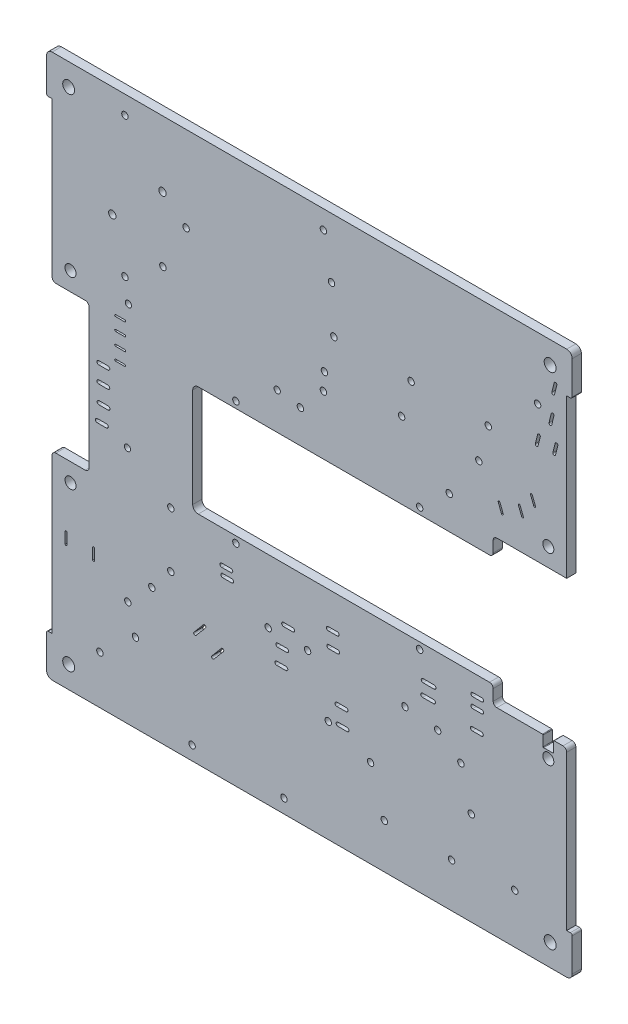
from build123d import *

# Parameters (mm, degrees)
SKETCH1_R           = 3
SKETCH1_R_2         = 3.25
SKETCH1_R_3         = 1.75
SKETCH1_R_4         = 2
SKETCH1_R_5         = 1.7
BOSS_EXTRUDE1_DEPTH = 5


with BuildPart() as part:
    # Sketch1 → Boss-Extrude1 (new body)
    with BuildSketch(Plane.XY):
        with BuildLine():
            Line((-60.5, 29.989761252), (98, 29.989761252))
            ThreePointArc((98, 29.989761252), (99.414213563, 30.57554769), (100, 31.989761252))
            Line((100, 31.989761252), (100, 37.971848155))
            ThreePointArc((100, 37.971848155), (100.585786438, 39.386061717), (102, 39.971848155))
            Line((102, 39.971848155), (140, 39.971848155))
            Line((140, 39.971848155), (140, 126))
            Line((140, 126), (142, 126))
            ThreePointArc((142, 126), (142.707106781, 126.292893219), (143, 127))
            Line((143, 127), (143, 145))
            ThreePointArc((143, 145), (142.121320344, 147.121320344), (140, 148))
            Line((140, 148), (-140, 148))
            ThreePointArc((-140, 148), (-142.121320344, 147.121320344), (-143, 145))
            Line((-143, 145), (-143, 127))
            ThreePointArc((-143, 127), (-142.707106781, 126.292893219), (-142, 126))
            Line((-142, 126), (-140, 126))
            Line((-140, 126), (-140, 41.971848155))
            ThreePointArc((-140, 41.971848155), (-139.414213563, 40.557634592), (-138, 39.971848155))
            Line((-138, 39.971848155), (-121.940250615, 39.971848155))
            ThreePointArc((-121.940250615, 39.971848155), (-120.526037052, 39.386061717), (-119.940250615, 37.971848155))
            Line((-119.940250615, 37.971848155), (-119.940250615, -38))
            ThreePointArc((-119.940250615, -38), (-120.526037052, -39.414213562), (-121.940250615, -40))
            Line((-121.940250615, -40), (-138, -40))
            ThreePointArc((-138, -40), (-139.414213563, -40.585786438), (-140, -42))
            Line((-140, -42), (-140, -126))
            Line((-140, -126), (-142, -126))
            ThreePointArc((-142, -126), (-142.707106781, -126.292893219), (-143, -127))
            Line((-143, -127), (-143, -145))
            ThreePointArc((-143, -145), (-142.121320344, -147.121320344), (-140, -148))
            Line((-140, -148), (140, -148))
            ThreePointArc((140, -148), (142.121320344, -147.121320344), (143, -145))
            Line((143, -145), (143, -127))
            ThreePointArc((143, -127), (142.707106781, -126.292893219), (142, -126))
            Line((142, -126), (140, -126))
            Line((140, -126), (140, -41.971848155))
            ThreePointArc((140, -41.971848155), (139.414213563, -40.557634592), (138, -39.971848155))
            Line((138, -39.971848155), (133.139339828, -39.971848155))
            ThreePointArc((133.139339828, -39.971848155), (132.927207794, -40.05971612), (132.839339828, -40.271848155))
            Line((132.839339828, -40.271848155), (132.839339828, -45.8))
            ThreePointArc((132.839339828, -45.8), (132.751471863, -46.012132034), (132.539339828, -46.1))
            Line((132.539339828, -46.1), (127.460660172, -46.1))
            ThreePointArc((127.460660172, -46.1), (127.248528137, -46.012132034), (127.160660172, -45.8))
            Line((127.160660172, -45.8), (127.160660172, -40.271848155))
            ThreePointArc((127.160660172, -40.271848155), (127.072792206, -40.05971612), (126.860660172, -39.971848155))
            Line((126.860660172, -39.971848155), (102, -39.971848155))
            ThreePointArc((102, -39.971848155), (100.585786438, -39.386061717), (100, -37.971848155))
            Line((100, -37.971848155), (100, -31.969286705))
            ThreePointArc((100, -31.969286705), (99.414213563, -30.555073142), (98, -29.969286705))
            Line((98, -29.969286705), (-60.5, -29.969286705))
            ThreePointArc((-60.5, -29.969286705), (-62.621320344, -29.090607048), (-63.5, -26.969286705))
            Line((-63.5, -26.969286705), (-63.5, 26.989761252))
            ThreePointArc((-63.5, 26.989761252), (-62.621320344, 29.111081596), (-60.5, 29.989761252))
        make_face()
        with Locations((130, 50)):
            Circle(SKETCH1_R, mode=Mode.SUBTRACT)
        with Locations((130, -50)):
            Circle(SKETCH1_R, mode=Mode.SUBTRACT)
        with Locations((-130, -50)):
            Circle(SKETCH1_R, mode=Mode.SUBTRACT)
        with Locations((-130, 50)):
            Circle(SKETCH1_R, mode=Mode.SUBTRACT)
        with Locations((-131, -136)):
            Circle(SKETCH1_R_2, mode=Mode.SUBTRACT)
        with Locations((131, -136)):
            Circle(SKETCH1_R_2, mode=Mode.SUBTRACT)
        with Locations((131, 136)):
            Circle(SKETCH1_R_2, mode=Mode.SUBTRACT)
        with Locations((-131, 136)):
            Circle(SKETCH1_R_2, mode=Mode.SUBTRACT)
        with Locations((111.735167126, -121.118147392)):
            Circle(SKETCH1_R_3, mode=Mode.SUBTRACT)
        with Locations((88.089296428, -97)):
            Circle(SKETCH1_R_3, mode=Mode.SUBTRACT)
        with Locations((-107.274737279, 87.823618227)):
            Circle(SKETCH1_R_4, mode=Mode.SUBTRACT)
        with Locations((-79.949331604, 112.172790794)):
            Circle(SKETCH1_R_4, mode=Mode.SUBTRACT)
        with Locations((-40, -33.489762726)):
            Circle(SKETCH1_R_3, mode=Mode.SUBTRACT)
        with Locations((60, -33.489762726)):
            Circle(SKETCH1_R_3, mode=Mode.SUBTRACT)
        with Locations((-40, 33.510237274)):
            Circle(SKETCH1_R_3, mode=Mode.SUBTRACT)
        with Locations((60, 33.510237274)):
            Circle(SKETCH1_R_3, mode=Mode.SUBTRACT)
        with Locations((-100.379541887, 62)):
            Circle(SKETCH1_R_3, mode=Mode.SUBTRACT)
        with Locations((-100.379541887, 138)):
            Circle(SKETCH1_R_3, mode=Mode.SUBTRACT)
        with Locations((7.620458113, 138)):
            Circle(SKETCH1_R_3, mode=Mode.SUBTRACT)
        with Locations((7.620458113, 62)):
            Circle(SKETCH1_R_3, mode=Mode.SUBTRACT)
        with Locations((-1, -64.5)):
            Circle(SKETCH1_R_3, mode=Mode.SUBTRACT)
        with Locations((52, -64.5)):
            Circle(SKETCH1_R_3, mode=Mode.SUBTRACT)
        with Locations((-75.417782129, -34.5)):
            Circle(SKETCH1_R_3, mode=Mode.SUBTRACT)
        with Locations((-75.417782129, -64.5)):
            Circle(SKETCH1_R_3, mode=Mode.SUBTRACT)
        with Locations((-22.417782129, -64.5)):
            Circle(SKETCH1_R_3, mode=Mode.SUBTRACT)
        with Locations((10.261866554, -92.30359925)):
            Circle(SKETCH1_R_3, mode=Mode.SUBTRACT)
        with Locations((-98.8, -90.511117637)):
            Circle(SKETCH1_R_3, mode=Mode.SUBTRACT)
        with Locations((-94.63536083, -105.074561655)):
            Circle(SKETCH1_R_3, mode=Mode.SUBTRACT)
        with Locations((-79.738533068, 76.998744433)):
            Circle(SKETCH1_R_3, mode=Mode.SUBTRACT)
        with Locations((-67.091659808, 101.631939393)):
            Circle(SKETCH1_R_3, mode=Mode.SUBTRACT)
        with Locations((-99, -18)):
            Circle(SKETCH1_R_5, mode=Mode.SUBTRACT)
        with Locations((-17.5, 50)):
            Circle(SKETCH1_R_5, mode=Mode.SUBTRACT)
        with Locations((-4.910703572, 48)):
            Circle(SKETCH1_R_3, mode=Mode.SUBTRACT)
        with Locations((-98.5, 50)):
            Circle(SKETCH1_R_5, mode=Mode.SUBTRACT)
        with Locations((76.089296428, 48)):
            Circle(SKETCH1_R_3, mode=Mode.SUBTRACT)
        with Locations((-13.827640689, -140.5)):
            Circle(SKETCH1_R_3, mode=Mode.SUBTRACT)
        with Locations((-63.827640689, -140.5)):
            Circle(SKETCH1_R_3, mode=Mode.SUBTRACT)
        with Locations((-114.01147389, -121.789083357)):
            Circle(SKETCH1_R_3, mode=Mode.SUBTRACT)
        with Locations((-85.744280955, -77.155295559)):
            Circle(SKETCH1_R_3, mode=Mode.SUBTRACT)
        with Locations((33.270940688, -100.113595946)):
            Circle(SKETCH1_R_3, mode=Mode.SUBTRACT)
        with Locations((82.412864467, -75.853711215)):
            Circle(SKETCH1_R_3, mode=Mode.SUBTRACT)
        with Locations((69.769451027, -66.675797144)):
            Circle(SKETCH1_R_3, mode=Mode.SUBTRACT)
        with Locations((124.173192615, 114.215338079)):
            Circle(SKETCH1_R_3, mode=Mode.SUBTRACT)
        with Locations((92.174345185, 71.467739287)):
            Circle(SKETCH1_R_3, mode=Mode.SUBTRACT)
        with Locations((97.33008389, 90.5)):
            Circle(SKETCH1_R_3, mode=Mode.SUBTRACT)
        with Locations((50.174345185, 71.467739287)):
            Circle(SKETCH1_R_3, mode=Mode.SUBTRACT)
        with Locations((55.33008389, 90.5)):
            Circle(SKETCH1_R_3, mode=Mode.SUBTRACT)
        with Locations((8.174345185, 71.467739287)):
            Circle(SKETCH1_R_3, mode=Mode.SUBTRACT)
        with Locations((13.33008389, 90.5)):
            Circle(SKETCH1_R_3, mode=Mode.SUBTRACT)
        with Locations((12.02216922, 115.450723129)):
            Circle(SKETCH1_R_3, mode=Mode.SUBTRACT)
        with Locations((40.756287932, -123.730711261)):
            Circle(SKETCH1_R_3, mode=Mode.SUBTRACT)
        with Locations((77.354553715, -124.087000003)):
            Circle(SKETCH1_R_3, mode=Mode.SUBTRACT)
        with BuildLine():
            Line((-131.911272873, -74.315327201), (-131.911272873, -80.315327201))
            ThreePointArc((-131.911272873, -80.315327201), (-132.411272873, -80.815327201), (-132.911272873, -80.315327201))
            Line((-132.911272873, -80.315327201), (-132.911272873, -74.315327201))
            ThreePointArc((-132.911272873, -74.315327201), (-132.411272873, -73.815327201), (-131.911272873, -74.315327201))
        make_face(mode=Mode.SUBTRACT)
        with BuildLine():
            Line((-116.911272873, -74.315327201), (-116.911272873, -80.315327201))
            ThreePointArc((-116.911272873, -80.315327201), (-117.411272873, -80.815327201), (-117.911272873, -80.315327201))
            Line((-117.911272873, -80.315327201), (-117.911272873, -74.315327201))
            ThreePointArc((-117.911272873, -74.315327201), (-117.411272873, -73.815327201), (-116.911272873, -74.315327201))
        make_face(mode=Mode.SUBTRACT)
        with BuildLine():
            Line((-105.436623555, 41.587008984), (-100.436623555, 41.587008984))
            ThreePointArc((-100.436623555, 41.587008984), (-99.936623555, 41.087008984), (-100.436623555, 40.587008984))
            Line((-100.436623555, 40.587008984), (-105.436623555, 40.587008984))
            ThreePointArc((-105.436623555, 40.587008984), (-105.936623555, 41.087008984), (-105.436623555, 41.587008984))
        make_face(mode=Mode.SUBTRACT)
        with BuildLine():
            Line((-105.436623555, 34.587008984), (-100.436623555, 34.587008984))
            ThreePointArc((-100.436623555, 34.587008984), (-99.936623555, 34.087008984), (-100.436623555, 33.587008984))
            Line((-100.436623555, 33.587008984), (-105.436623555, 33.587008984))
            ThreePointArc((-105.436623555, 33.587008984), (-105.936623555, 34.087008984), (-105.436623555, 34.587008984))
        make_face(mode=Mode.SUBTRACT)
        with BuildLine():
            Line((-105.436623555, 27.587008984), (-100.436623555, 27.587008984))
            ThreePointArc((-100.436623555, 27.587008984), (-99.936623555, 27.087008984), (-100.436623555, 26.587008984))
            Line((-100.436623555, 26.587008984), (-105.436623555, 26.587008984))
            ThreePointArc((-105.436623555, 26.587008984), (-105.936623555, 27.087008984), (-105.436623555, 27.587008984))
        make_face(mode=Mode.SUBTRACT)
        with BuildLine():
            Line((-105.436623555, 20.587008984), (-100.436623555, 20.587008984))
            ThreePointArc((-100.436623555, 20.587008984), (-99.936623555, 20.087008984), (-100.436623555, 19.587008984))
            Line((-100.436623555, 19.587008984), (-105.436623555, 19.587008984))
            ThreePointArc((-105.436623555, 19.587008984), (-105.936623555, 20.087008984), (-105.436623555, 20.587008984))
        make_face(mode=Mode.SUBTRACT)
        with BuildLine():
            Line((-56.506516854, -81.628617091), (-61.660412293, -87.747224923))
            ThreePointArc((-61.660412293, -87.747224923), (-62.717209475, -87.83766671), (-62.807651262, -86.780869528))
            Line((-62.807651262, -86.780869528), (-57.653755822, -80.662261696))
            ThreePointArc((-57.653755822, -80.662261696), (-56.59695864, -80.57181991), (-56.506516854, -81.628617091))
        make_face(mode=Mode.SUBTRACT)
        with BuildLine():
            Line((-53.083608186, -93.087243855), (-47.929712747, -86.968636023))
            ThreePointArc((-47.929712747, -86.968636023), (-46.872915565, -86.878194237), (-46.782473778, -87.934991418))
            Line((-46.782473778, -87.934991418), (-51.936369218, -94.05359925))
            ThreePointArc((-51.936369218, -94.05359925), (-52.9931664, -94.144041037), (-53.083608186, -93.087243855))
        make_face(mode=Mode.SUBTRACT)
        with BuildLine():
            Line((-114.631081019, 15.300232941), (-109.631081019, 15.300232941))
            ThreePointArc((-109.631081019, 15.300232941), (-108.631081019, 14.300232941), (-109.631081019, 13.300232941))
            Line((-109.631081019, 13.300232941), (-114.631081019, 13.300232941))
            ThreePointArc((-114.631081019, 13.300232941), (-115.631081019, 14.300232941), (-114.631081019, 15.300232941))
        make_face(mode=Mode.SUBTRACT)
        with BuildLine():
            Line((-114.631081019, 6.249710876), (-109.631081019, 6.249710876))
            ThreePointArc((-109.631081019, 6.249710876), (-108.631081019, 5.249710876), (-109.631081019, 4.249710876))
            Line((-109.631081019, 4.249710876), (-114.631081019, 4.249710876))
            ThreePointArc((-114.631081019, 4.249710876), (-115.631081019, 5.249710876), (-114.631081019, 6.249710876))
        make_face(mode=Mode.SUBTRACT)
        with BuildLine():
            Line((-114.492886616, -3.487647924), (-109.492886616, -3.487647924))
            ThreePointArc((-109.492886616, -3.487647924), (-108.492886616, -4.487647924), (-109.492886616, -5.487647924))
            Line((-109.492886616, -5.487647924), (-114.492886616, -5.487647924))
            ThreePointArc((-114.492886616, -5.487647924), (-115.492886616, -4.487647924), (-114.492886616, -3.487647924))
        make_face(mode=Mode.SUBTRACT)
        with BuildLine():
            Line((-115.445462796, -12.404175498), (-110.445462796, -12.404175498))
            ThreePointArc((-110.445462796, -12.404175498), (-109.445462796, -13.404175498), (-110.445462796, -14.404175498))
            Line((-110.445462796, -14.404175498), (-115.445462796, -14.404175498))
            ThreePointArc((-115.445462796, -14.404175498), (-116.445462796, -13.404175498), (-115.445462796, -12.404175498))
        make_face(mode=Mode.SUBTRACT)
        with BuildLine():
            Line((-14.064477053, -57.77802484), (-9.064477053, -57.77802484))
            ThreePointArc((-9.064477053, -57.77802484), (-8.064477053, -58.77802484), (-9.064477053, -59.77802484))
            Line((-9.064477053, -59.77802484), (-14.064477053, -59.77802484))
            ThreePointArc((-14.064477053, -59.77802484), (-15.064477053, -58.77802484), (-14.064477053, -57.77802484))
        make_face(mode=Mode.SUBTRACT)
        with BuildLine():
            Line((10.450688105, -55.936359309), (15.450688105, -55.936359309))
            ThreePointArc((15.450688105, -55.936359309), (16.450688105, -56.936359309), (15.450688105, -57.936359309))
            Line((15.450688105, -57.936359309), (10.450688105, -57.936359309))
            ThreePointArc((10.450688105, -57.936359309), (9.450688105, -56.936359309), (10.450688105, -55.936359309))
        make_face(mode=Mode.SUBTRACT)
        with BuildLine():
            Line((-47.703927261, -46.668691522), (-42.703927261, -46.668691522))
            ThreePointArc((-42.703927261, -46.668691522), (-41.703927261, -47.668691522), (-42.703927261, -48.668691522))
            Line((-42.703927261, -48.668691522), (-47.703927261, -48.668691522))
            ThreePointArc((-47.703927261, -48.668691522), (-48.703927261, -47.668691522), (-47.703927261, -46.668691522))
        make_face(mode=Mode.SUBTRACT)
        with BuildLine():
            Line((-47.240543871, -51.302525415), (-42.240543871, -51.302525415))
            ThreePointArc((-42.240543871, -51.302525415), (-41.240543871, -52.302525415), (-42.240543871, -53.302525415))
            Line((-42.240543871, -53.302525415), (-47.240543871, -53.302525415))
            ThreePointArc((-47.240543871, -53.302525415), (-48.240543871, -52.302525415), (-47.240543871, -51.302525415))
        make_face(mode=Mode.SUBTRACT)
        with BuildLine():
            Line((10.21899641, -47.5954583), (15.21899641, -47.5954583))
            ThreePointArc((15.21899641, -47.5954583), (16.21899641, -48.5954583), (15.21899641, -49.5954583))
            Line((15.21899641, -49.5954583), (10.21899641, -49.5954583))
            ThreePointArc((10.21899641, -49.5954583), (9.21899641, -48.5954583), (10.21899641, -47.5954583))
        make_face(mode=Mode.SUBTRACT)
        with BuildLine():
            Line((-17.311676534, -69.105970096), (-12.311676534, -69.105970096))
            ThreePointArc((-12.311676534, -69.105970096), (-11.311676534, -70.105970096), (-12.311676534, -71.105970096))
            Line((-12.311676534, -71.105970096), (-17.311676534, -71.105970096))
            ThreePointArc((-17.311676534, -71.105970096), (-18.311676534, -70.105970096), (-17.311676534, -69.105970096))
        make_face(mode=Mode.SUBTRACT)
        with BuildLine():
            Line((-17.77320639, -77.875037356), (-12.77320639, -77.875037356))
            ThreePointArc((-12.77320639, -77.875037356), (-11.77320639, -78.875037356), (-12.77320639, -79.875037356))
            Line((-12.77320639, -79.875037356), (-17.77320639, -79.875037356))
            ThreePointArc((-17.77320639, -79.875037356), (-18.77320639, -78.875037356), (-17.77320639, -77.875037356))
        make_face(mode=Mode.SUBTRACT)
        with BuildLine():
            Line((88.808730197, -39.369003717), (93.808730197, -39.369003717))
            ThreePointArc((93.808730197, -39.369003717), (94.808730197, -40.369003717), (93.808730197, -41.369003717))
            Line((93.808730197, -41.369003717), (88.808730197, -41.369003717))
            ThreePointArc((88.808730197, -41.369003717), (87.808730197, -40.369003717), (88.808730197, -39.369003717))
        make_face(mode=Mode.SUBTRACT)
        with BuildLine():
            Line((88.808730197, -45.00355282), (93.808730197, -45.00355282))
            ThreePointArc((93.808730197, -45.00355282), (94.808730197, -46.00355282), (93.808730197, -47.00355282))
            Line((93.808730197, -47.00355282), (88.808730197, -47.00355282))
            ThreePointArc((88.808730197, -47.00355282), (87.808730197, -46.00355282), (88.808730197, -45.00355282))
        make_face(mode=Mode.SUBTRACT)
        with BuildLine():
            Line((88.635359455, -55.579168058), (93.635359455, -55.579168058))
            ThreePointArc((93.635359455, -55.579168058), (94.635359455, -56.579168058), (93.635359455, -57.579168058))
            Line((93.635359455, -57.579168058), (88.635359455, -57.579168058))
            ThreePointArc((88.635359455, -57.579168058), (87.635359455, -56.579168058), (88.635359455, -55.579168058))
        make_face(mode=Mode.SUBTRACT)
        with BuildLine():
            Line((114.635264011, 61.800836838), (116.445884512, 57.140187377))
            ThreePointArc((116.445884512, 57.140187377), (116.160881616, 56.493060381), (115.51375462, 56.778063277))
            Line((115.51375462, 56.778063277), (113.703134119, 61.438712738))
            ThreePointArc((113.703134119, 61.438712738), (113.988137015, 62.085839734), (114.635264011, 61.800836838))
        make_face(mode=Mode.SUBTRACT)
        with BuildLine():
            Line((103.65511066, 57.727326156), (105.465731161, 53.066676695))
            ThreePointArc((105.465731161, 53.066676695), (105.180728265, 52.419549699), (104.533601269, 52.704552595))
            Line((104.533601269, 52.704552595), (102.722980768, 57.365202056))
            ThreePointArc((102.722980768, 57.365202056), (103.007983664, 58.012329052), (103.65511066, 57.727326156))
        make_face(mode=Mode.SUBTRACT)
        with BuildLine():
            Line((121.225504305, 70.076952556), (123.036124806, 65.416303095))
            ThreePointArc((123.036124806, 65.416303095), (122.75112191, 64.769176099), (122.103994914, 65.054178995))
            Line((122.103994914, 65.054178995), (120.293374413, 69.714828456))
            ThreePointArc((120.293374413, 69.714828456), (120.578377309, 70.361955453), (121.225504305, 70.076952556))
        make_face(mode=Mode.SUBTRACT)
        with BuildLine():
            Line((61.850042883, -46.301015684), (67.850042883, -46.301015684))
            ThreePointArc((67.850042883, -46.301015684), (68.850042883, -47.301015684), (67.850042883, -48.301015684))
            Line((67.850042883, -48.301015684), (61.850042883, -48.301015684))
            ThreePointArc((61.850042883, -48.301015684), (60.850042883, -47.301015684), (61.850042883, -46.301015684))
        make_face(mode=Mode.SUBTRACT)
        with BuildLine():
            Line((61.569562973, -53.313013434), (67.569562973, -53.313013434))
            ThreePointArc((67.569562973, -53.313013434), (68.569562973, -54.313013434), (67.569562973, -55.313013434))
            Line((67.569562973, -55.313013434), (61.569562973, -55.313013434))
            ThreePointArc((61.569562973, -55.313013434), (60.569562973, -54.313013434), (61.569562973, -53.313013434))
        make_face(mode=Mode.SUBTRACT)
        with BuildLine():
            Line((130.379108983, 108.49667323), (131.624329303, 113.49667323))
            ThreePointArc((131.624329303, 113.49667323), (132.533346445, 114.043196638), (133.079869853, 113.134179496))
            Line((133.079869853, 113.134179496), (131.834649533, 108.134179496))
            ThreePointArc((131.834649533, 108.134179496), (130.925632391, 107.587656088), (130.379108983, 108.49667323))
        make_face(mode=Mode.SUBTRACT)
        with BuildLine():
            Line((131.911638533, 123.707184619), (133.156858852, 128.707184619))
            ThreePointArc((133.156858852, 128.707184619), (134.065875994, 129.253708028), (134.612399402, 128.344690886))
            Line((134.612399402, 128.344690886), (133.367179083, 123.344690886))
            ThreePointArc((133.367179083, 123.344690886), (132.458161941, 122.798167477), (131.911638533, 123.707184619))
        make_face(mode=Mode.SUBTRACT)
        with BuildLine():
            Line((122.92034271, 94.905404854), (124.16556303, 99.905404854))
            ThreePointArc((124.16556303, 99.905404854), (125.074580171, 100.451928262), (125.62110358, 99.54291112))
            Line((125.62110358, 99.54291112), (124.37588326, 94.54291112))
            ThreePointArc((124.37588326, 94.54291112), (123.466866118, 93.996387712), (122.92034271, 94.905404854))
        make_face(mode=Mode.SUBTRACT)
        with BuildLine():
            Line((132.497737652, 95.472375682), (133.742957972, 100.472375682))
            ThreePointArc((133.742957972, 100.472375682), (134.651975114, 101.018899091), (135.198498522, 100.109881949))
            Line((135.198498522, 100.109881949), (133.953278202, 95.109881949))
            ThreePointArc((133.953278202, 95.109881949), (133.04426106, 94.56335854), (132.497737652, 95.472375682))
        make_face(mode=Mode.SUBTRACT)
        with BuildLine():
            Line((14.962162044, -80.884589185), (19.962162044, -80.884589185))
            ThreePointArc((19.962162044, -80.884589185), (20.962162044, -81.884589185), (19.962162044, -82.884589185))
            Line((19.962162044, -82.884589185), (14.962162044, -82.884589185))
            ThreePointArc((14.962162044, -82.884589185), (13.962162044, -81.884589185), (14.962162044, -80.884589185))
        make_face(mode=Mode.SUBTRACT)
        with BuildLine():
            Line((15.497549862, -89.986182095), (20.497549862, -89.986182095))
            ThreePointArc((20.497549862, -89.986182095), (21.497549862, -90.986182095), (20.497549862, -91.986182095))
            Line((20.497549862, -91.986182095), (15.497549862, -91.986182095))
            ThreePointArc((15.497549862, -91.986182095), (14.497549862, -90.986182095), (15.497549862, -89.986182095))
        make_face(mode=Mode.SUBTRACT)
    extrude(amount=BOSS_EXTRUDE1_DEPTH)


solid = part.part
